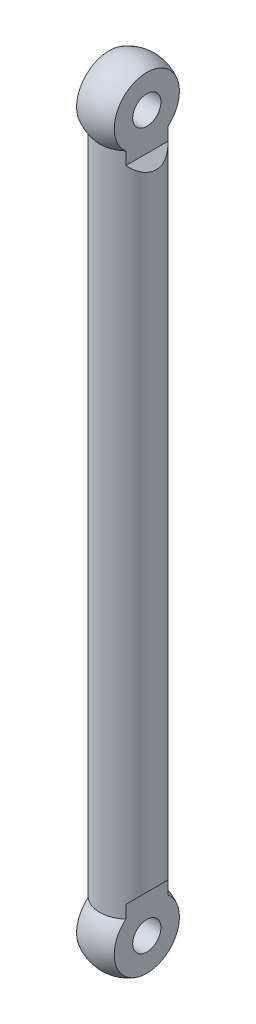
from build123d import *

# Parameters (mm, degrees)
CUT_EXTRUDE_1_DEPTH      = 81.199750623
CUT_EXTRUDE_2_DEPTH      = 81.255840909
CUT_EXTRUDE_2_DEPTH_BACK = 81.255840909
SKETCH_3_R               = 1.5
CUT_EXTRUDE_3_DEPTH      = 81.255840909
CUT_EXTRUDE_3_DEPTH_BACK = 81.255840909
SKETCH_4_R               = 1.5


with BuildPart() as part:
    # 草图1 → 旋转7 (revolve)
    with BuildSketch(Plane(origin=(0, 0, 0), x_dir=(0, 0, -1), z_dir=(1, 0, 0))):
        with BuildLine():
            Line((0, 80), (0, -4))
            ThreePointArc((0, -4), (3.645751311, -1.645751311), (3, 2.645751311))
            Line((3, 2.645751311), (3, 73.354248689))
            ThreePointArc((3, 73.354248689), (3.645751311, 77.645751311), (0, 80))
        make_face()
    revolve(axis=Axis((0, -21.628406948, 0), (0, 1, 0)))

    # 草图2 → 切除-拉伸1 (cut, symmetric)
    with BuildSketch(Plane.XY):
        Polygon((2, 85.145201401), (2, 72), (3, 71), (8.111541525, 71), (8.111541525, 85.145201401), align=None)
        Polygon((8.111541525, -9.145201401), (2, -9.145201401), (2, 4), (3, 5), (8.111541525, 5), align=None)
    cut_extrude_1 = extrude(amount=CUT_EXTRUDE_1_DEPTH, both=True, mode=Mode.SUBTRACT)

    # 镜向1: 切除-拉伸1 across plane
    add(cut_extrude_1.mirror(Plane(origin=(0, 0, 0), x_dir=(0, 0, 1), z_dir=(1, 0, 0))), mode=Mode.SUBTRACT)

    # 草图3 → 切除-拉伸2 (cut, two sides: drawn at the far end of the back side and taken through both)
    with BuildSketch(Plane(origin=(2, 0, 0), x_dir=(0, 0, -1), z_dir=(1, 0, 0)).offset(-CUT_EXTRUDE_2_DEPTH_BACK)):
        with Locations(Location((0, 76, 0), (0, 0, 270))):
            Circle(SKETCH_3_R)
    extrude(amount=CUT_EXTRUDE_2_DEPTH + CUT_EXTRUDE_2_DEPTH_BACK, mode=Mode.SUBTRACT)

    # 草图4 → 切除-拉伸3 (cut, two sides: drawn at the far end of the back side and taken through both)
    with BuildSketch(Plane(origin=(2, 0, 0), x_dir=(0, 0, -1), z_dir=(1, 0, 0)).offset(-CUT_EXTRUDE_3_DEPTH_BACK)):
        with Locations(Location((0, 0, 0), (0, 0, 270))):
            Circle(SKETCH_4_R)
    extrude(amount=CUT_EXTRUDE_3_DEPTH + CUT_EXTRUDE_3_DEPTH_BACK, mode=Mode.SUBTRACT)


solid = part.part
